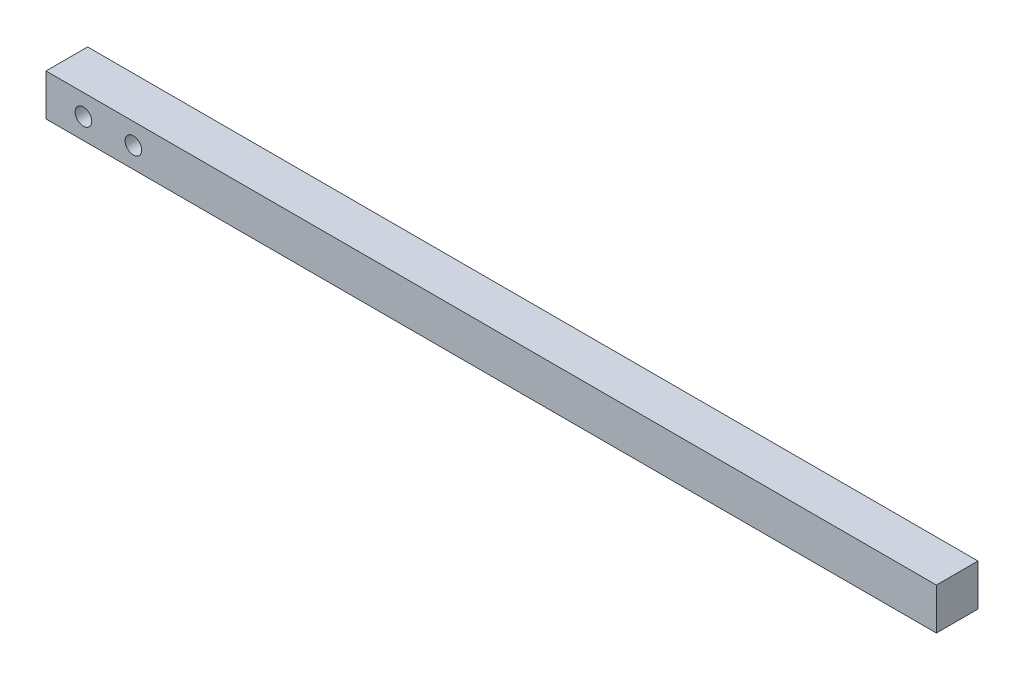
from build123d import *

# Parameters (mm, degrees)
SKETCH_1_W          = 10
SKETCH_1_H          = 10
EXTRUDE_1_DEPTH     = 214
SKETCH_2_R          = 2
CUT_EXTRUDE_1_DEPTH = 215.291857055


with BuildPart() as part:
    # Эскиз1 → Вытянуть1 (new body)
    with BuildSketch(Plane(origin=(0, 0, 0), x_dir=(0, 0, -1), z_dir=(1, 0, 0))):
        Rectangle(SKETCH_1_W, SKETCH_1_H)
    extrude(amount=EXTRUDE_1_DEPTH)

    # Эскиз2 → Вырез-Вытянуть1 (cut, through all)
    with BuildSketch(Plane.XY.offset(5)):
        with Locations((9, 0)):
            Circle(SKETCH_2_R)
        with Locations((21, 0)):
            Circle(SKETCH_2_R)
    extrude(amount=-CUT_EXTRUDE_1_DEPTH, mode=Mode.SUBTRACT)


solid = part.part
